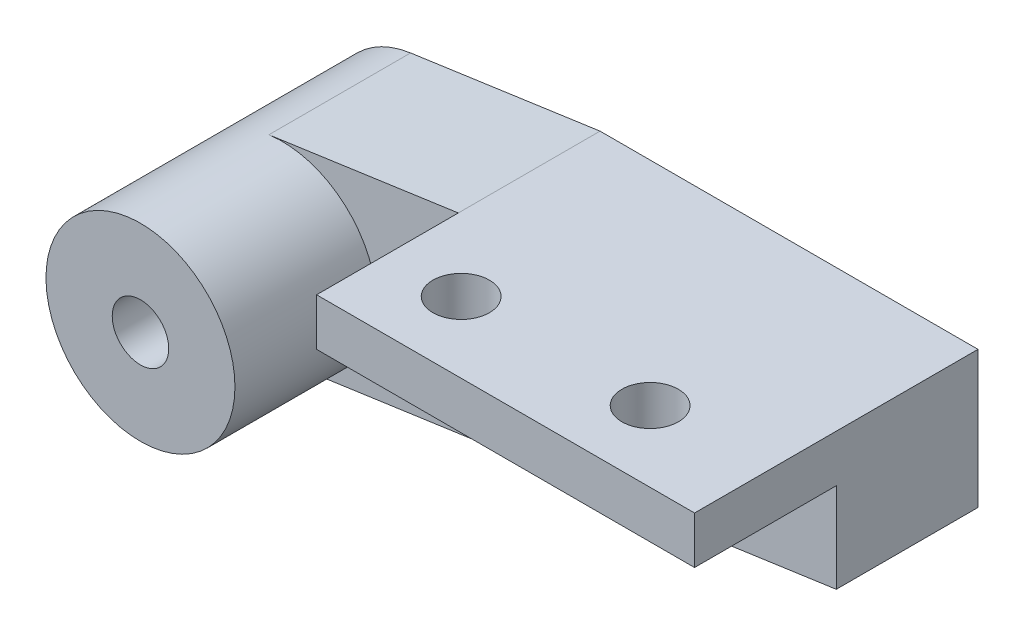
from build123d import *

# Parameters (mm, degrees)
BOSS_EXTRUDE1_DEPTH   = 9.525
SKETCH4_R             = 6.35
SKETCH4_W             = 25.4
SKETCH4_H             = 3.175
BOSS_EXTRUDE2_DEPTH   = 9.525
F_6_CLEARANCE_HOLE1_D = 3.7973
F_6_CLEARANCE_HOLE2_D = 3.7973


with BuildPart() as part:
    # Sketch1 → Boss-Extrude1 (new body)
    with BuildSketch(Plane.XY):
        with BuildLine():
            Line((11.8364, 8.1026), (-0.896679191, 6.286371483))
            ThreePointArc((-0.896679191, 6.286371483), (-6.286371483, -0.896679191), (0.896679191, -6.286371483))
            Line((0.896679191, -6.286371483), (37.2364, -1.102924791))
            Line((37.2364, -1.102924791), (37.2364, 8.1026))
            Line((37.2364, 8.1026), (11.8364, 8.1026))
        make_face()
    extrude(amount=BOSS_EXTRUDE1_DEPTH)

    # Sketch4 → Boss-Extrude2 (add)
    with BuildSketch(Plane.XY.offset(9.525)):
        with Locations(Location((0, 0, 0), (0, 0, 98.117830505))):
            Circle(SKETCH4_R)
        with Locations((24.5364, 6.5151)):
            Rectangle(SKETCH4_W, SKETCH4_H)
    extrude(amount=BOSS_EXTRUDE2_DEPTH)

    # #6 Clearance Hole1 (through all)
    with Locations(Plane(origin=(0, 0, 0), x_dir=(-1, 0, 0), z_dir=(0, 0, -1))):
        with Locations((0, 0)):
            Hole(F_6_CLEARANCE_HOLE1_D / 2)

    # #6 Clearance Hole2 (through all)
    with Locations(Plane(origin=(16.7894, 4.9276, 14.2875), x_dir=(-1, 0, 0), z_dir=(0, -1, 0))):
        with Locations((0, 0), (-12.7, 0)):
            Hole(F_6_CLEARANCE_HOLE2_D / 2)


solid = part.part
